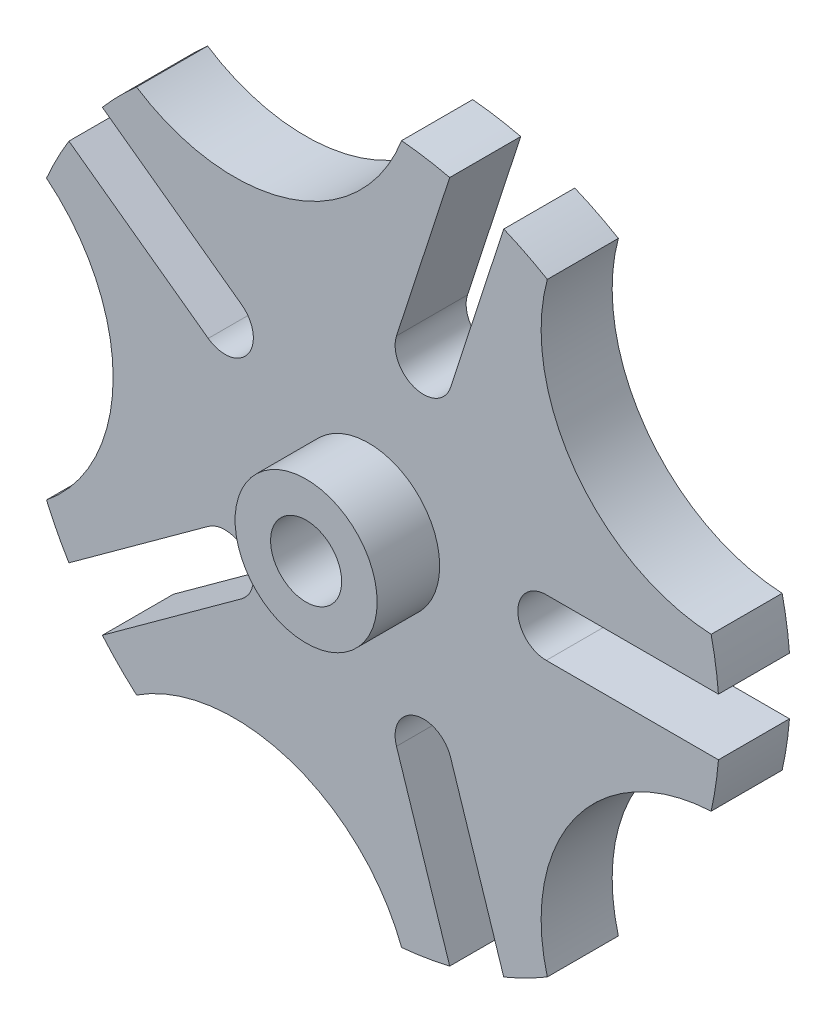
from build123d import *

# Parameters (mm, degrees)
BOSS_EXTRUDE1_DEPTH = 6.35
SKETCH2_R           = 6.35
SKETCH2_R_2         = 3.175
BOSS_EXTRUDE2_DEPTH = 5.588
SKETCH2_2_R         = 6.35
SKETCH2_2_R_2       = 3.175
CUT_EXTRUDE1_DEPTH  = 45.645295473


with BuildPart() as part:
    # Sketch1 → Boss-Extrude1 (new body)
    with BuildSketch(Plane.XY):
        with BuildLine():
            ThreePointArc((15.6718, 2.531858953), (15.773318492, 2.537963922), (15.875, 2.54))
            Line((15.875, 2.54), (31.265996882, 2.54))
            ThreePointArc((31.265996882, 2.54), (31.014248813, 4.704309891), (30.612864998, 6.845922701))
            ThreePointArc((30.612864998, 6.845922701), (18.47357946, 13.421841122), (15.970754926, 26.999058282))
            ThreePointArc((15.970754926, 26.999058282), (14.057994528, 28.042591729), (12.077407934, 28.950826907))
            Line((12.077407934, 28.950826907), (7.321328337, 14.31311903))
            ThreePointArc((7.321328337, 14.31311903), (7.287970598, 14.217043352), (7.250793488, 14.122380068))
            ThreePointArc((7.250793488, 14.122380068), (4.12074162, 12.682338645), (2.434911576, 15.687154956))
            ThreePointArc((2.434911576, 15.687154956), (2.460476345, 15.785591318), (2.489961234, 15.882925362))
            Line((2.489961234, 15.882925362), (7.246040831, 30.520633238))
            ThreePointArc((7.246040831, 30.520633238), (5.109865374, 30.950015135), (2.949036136, 31.230071195))
            ThreePointArc((2.949036136, 31.230071195), (-7.05627946, 21.716995127), (-20.742395628, 23.532258383))
            ThreePointArc((-20.742395628, 23.532258383), (-22.325930381, 22.035584712), (-23.801748282, 20.432595031))
            Line((-23.801748282, 20.432595031), (-11.350170245, 11.385994046))
            ThreePointArc((-11.350170245, 11.385994046), (-11.269104953, 11.324579933), (-11.190563179, 11.259969838))
            ThreePointArc((-11.190563179, 11.259969838), (-10.78824162, 7.838116339), (-14.166941886, 7.163335996))
            ThreePointArc((-14.166941886, 7.163335996), (-14.252660482, 7.218068045), (-14.336119327, 7.276187714))
            Line((-14.336119327, 7.276187714), (-26.787697364, 16.3227887))
            ThreePointArc((-26.787697364, 16.3227887), (-27.856178334, 14.423851415), (-28.790260432, 12.455322769))
            ThreePointArc((-28.790260432, 12.455322769), (-22.8346, 0), (-28.790260432, -12.455322769))
            ThreePointArc((-28.790260432, -12.455322769), (-27.856178334, -14.423851415), (-26.787697364, -16.3227887))
            Line((-26.787697364, -16.3227887), (-14.336119327, -7.276187714))
            ThreePointArc((-14.336119327, -7.276187714), (-14.252660482, -7.218068045), (-14.166941886, -7.163335996))
            ThreePointArc((-14.166941886, -7.163335996), (-10.78824162, -7.838116339), (-11.190563179, -11.259969838))
            ThreePointArc((-11.190563179, -11.259969838), (-11.269104953, -11.324579933), (-11.350170245, -11.385994046))
            Line((-11.350170245, -11.385994046), (-23.801748282, -20.432595031))
            ThreePointArc((-23.801748282, -20.432595031), (-22.325930381, -22.035584712), (-20.742395628, -23.532258383))
            ThreePointArc((-20.742395628, -23.532258383), (-7.05627946, -21.716995127), (2.949036136, -31.230071195))
            ThreePointArc((2.949036136, -31.230071195), (5.109865374, -30.950015135), (7.246040831, -30.520633238))
            Line((7.246040831, -30.520633238), (2.489961234, -15.882925362))
            ThreePointArc((2.489961234, -15.882925362), (2.460476345, -15.785591318), (2.434911576, -15.687154956))
            ThreePointArc((2.434911576, -15.687154956), (4.12074162, -12.682338645), (7.250793488, -14.122380068))
            ThreePointArc((7.250793488, -14.122380068), (7.287970598, -14.217043352), (7.321328337, -14.31311903))
            Line((7.321328337, -14.31311903), (12.077407934, -28.950826907))
            ThreePointArc((12.077407934, -28.950826907), (14.057994528, -28.042591729), (15.970754926, -26.999058282))
            ThreePointArc((15.970754926, -26.999058282), (18.47357946, -13.421841122), (30.612864998, -6.845922701))
            ThreePointArc((30.612864998, -6.845922701), (31.014248813, -4.704309891), (31.265996882, -2.54))
            Line((31.265996882, -2.54), (15.875, -2.54))
            ThreePointArc((15.875, -2.54), (15.773318492, -2.537963922), (15.6718, -2.531858953))
            ThreePointArc((15.6718, -2.531858953), (13.335, 0), (15.6718, 2.531858953))
        make_face()
    extrude(amount=BOSS_EXTRUDE1_DEPTH)

    # Sketch2 → Boss-Extrude2 (add)
    with BuildSketch(Plane.XY.offset(6.35)):
        Circle(SKETCH2_R)
        Circle(SKETCH2_R_2, mode=Mode.SUBTRACT)
    extrude(amount=BOSS_EXTRUDE2_DEPTH)

    # Sketch2<2> → Cut-Extrude1 (cut, through all)
    with BuildSketch(Plane.XY.offset(6.35)):
        Circle(SKETCH2_2_R)
        Circle(SKETCH2_2_R_2, mode=Mode.SUBTRACT)
    extrude(amount=-CUT_EXTRUDE1_DEPTH, mode=Mode.SUBTRACT)


with BuildPart() as cut_extrude1_piece_1:
    # of the separate pieces the step leaves, piece 1, a body of its own (cut_extrude1_pieces_kept)
    add(part.part.solids().sort_by_distance((-14.336119327, -7.276187714, 0))[0])


with BuildPart() as cut_extrude1_piece_2:
    # of the separate pieces the step leaves, piece 2, a body of its own (cut_extrude1_pieces_kept)
    add(part.part.solids().sort_by_distance((6.35, 0, 11.938))[0])


solid = Compound([cut_extrude1_piece_1.part, cut_extrude1_piece_2.part])
